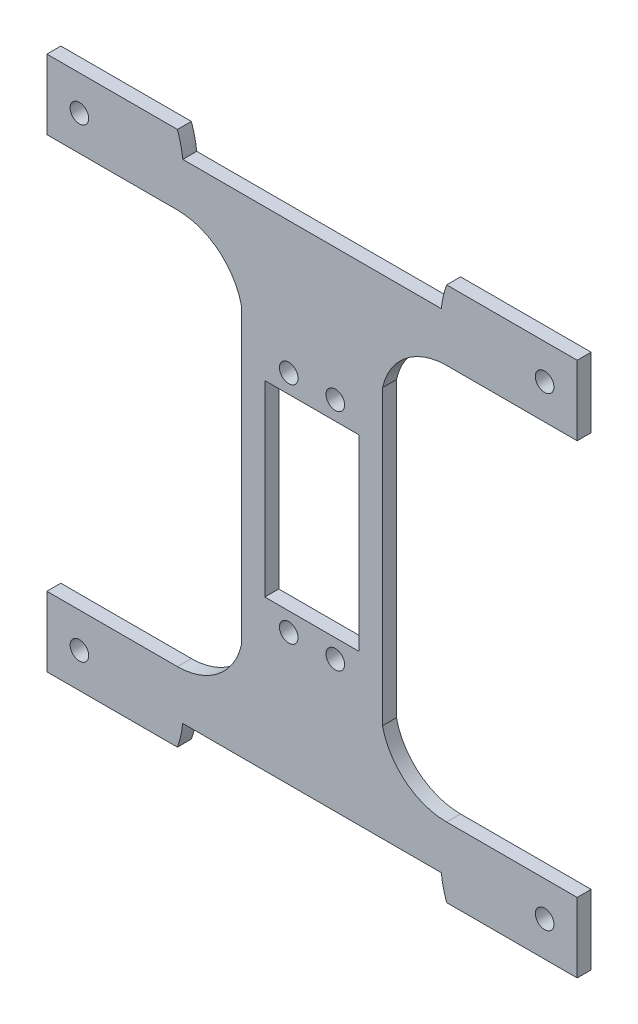
from build123d import *

# Parameters (mm, degrees)
CROQUIS2_R              = 2
CROQUIS2_W              = 20.3
CROQUIS2_H              = 40.3
SALIENTE_EXTRUIR2_DEPTH = 3


with BuildPart() as part:
    # Croquis2 → Saliente-Extruir2 (new body)
    with BuildSketch(Plane.XY):
        with BuildLine():
            Line((54.85, 71.478027684), (54.85, 8.521972316))
            ThreePointArc((54.85, 8.521972316), (49.890052554, 0.594274169), (41.065374433, -2.5))
            Line((41.065374433, -2.5), (13, -2.5))
            Line((13, -2.5), (13, -17.5))
            Line((13, -17.5), (41.065374433, -17.5))
            ThreePointArc((41.065374433, -17.5), (41.786840737, -15.033246538), (42.220486043, -12.5))
            Line((42.220486043, -12.5), (67.5, -12.5))
            Line((67.5, -12.5), (72.5, -12.5))
            Line((72.5, -12.5), (97.779513957, -12.5))
            ThreePointArc((97.779513957, -12.5), (98.213159263, -15.033246538), (98.934625567, -17.5))
            Line((98.934625567, -17.5), (127, -17.5))
            Line((127, -17.5), (127, -2.5))
            Line((127, -2.5), (98.934625567, -2.5))
            ThreePointArc((98.934625567, -2.5), (90.109947446, 0.594274169), (85.15, 8.521972316))
            Line((85.15, 8.521972316), (85.15, 71.478027684))
            ThreePointArc((85.15, 71.478027684), (90.109947446, 79.405725831), (98.934625567, 82.5))
            Line((98.934625567, 82.5), (127, 82.5))
            Line((127, 82.5), (127, 97.5))
            Line((127, 97.5), (98.934625567, 97.5))
            ThreePointArc((98.934625567, 97.5), (98.213159263, 95.033246538), (97.779513957, 92.5))
            Line((97.779513957, 92.5), (72.5, 92.5))
            Line((72.5, 92.5), (67.5, 92.5))
            Line((67.5, 92.5), (42.220486043, 92.5))
            ThreePointArc((42.220486043, 92.5), (41.786840737, 95.033246538), (41.065374433, 97.5))
            Line((41.065374433, 97.5), (13, 97.5))
            Line((13, 97.5), (13, 82.5))
            Line((13, 82.5), (41.065374433, 82.5))
            ThreePointArc((41.065374433, 82.5), (49.890052554, 79.405725831), (54.85, 71.478027684))
        make_face()
        with Locations((65, 64.15)):
            Circle(CROQUIS2_R, mode=Mode.SUBTRACT)
        with Locations(Location((75, 64.15, 0), (0, 0, 180))):
            Circle(CROQUIS2_R, mode=Mode.SUBTRACT)
        with Locations((75, 15.85)):
            Circle(CROQUIS2_R, mode=Mode.SUBTRACT)
        with Locations(Location((65, 15.85, 0), (0, 0, 180))):
            Circle(CROQUIS2_R, mode=Mode.SUBTRACT)
        with Locations((20, -10)):
            Circle(CROQUIS2_R, mode=Mode.SUBTRACT)
        with Locations(Location((120, -10, 0), (0, 0, 180))):
            Circle(CROQUIS2_R, mode=Mode.SUBTRACT)
        with Locations((120, 90)):
            Circle(CROQUIS2_R, mode=Mode.SUBTRACT)
        with Locations(Location((20, 90, 0), (0, 0, 180))):
            Circle(CROQUIS2_R, mode=Mode.SUBTRACT)
        with Locations((70, 40)):
            Rectangle(CROQUIS2_W, CROQUIS2_H, mode=Mode.SUBTRACT)
    extrude(amount=SALIENTE_EXTRUIR2_DEPTH)


solid = part.part
